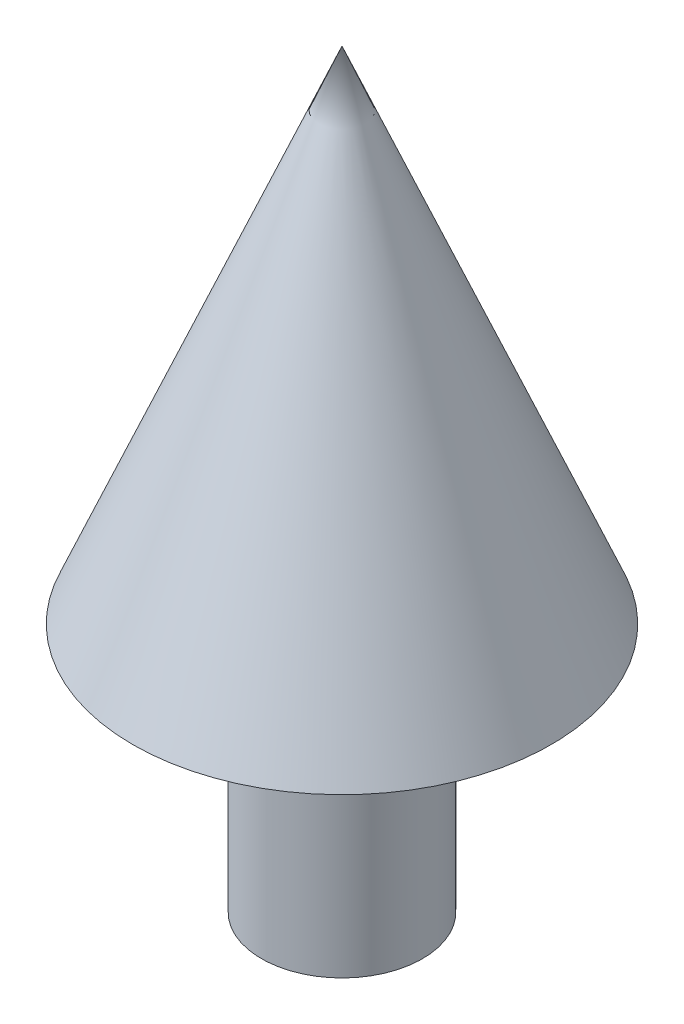
from build123d import *


with BuildPart() as part:
    # Sketch1 → Revolve1 (revolve)
    with BuildSketch(Plane.XY, mode=Mode.PRIVATE) as revolve1_sk:
        Polygon((0, 0), (0, 914.4), (254.902239382, 304.329266409), (98.147953668, 365.053899614), (98.147953668, 0), align=None)
    revolve(revolve1_sk.sketch.rotate(Axis((0, 0, 0), (0, 1, 0)), 90), axis=Axis((0, 0, 0), (0, 1, 0)))


solid = part.part
